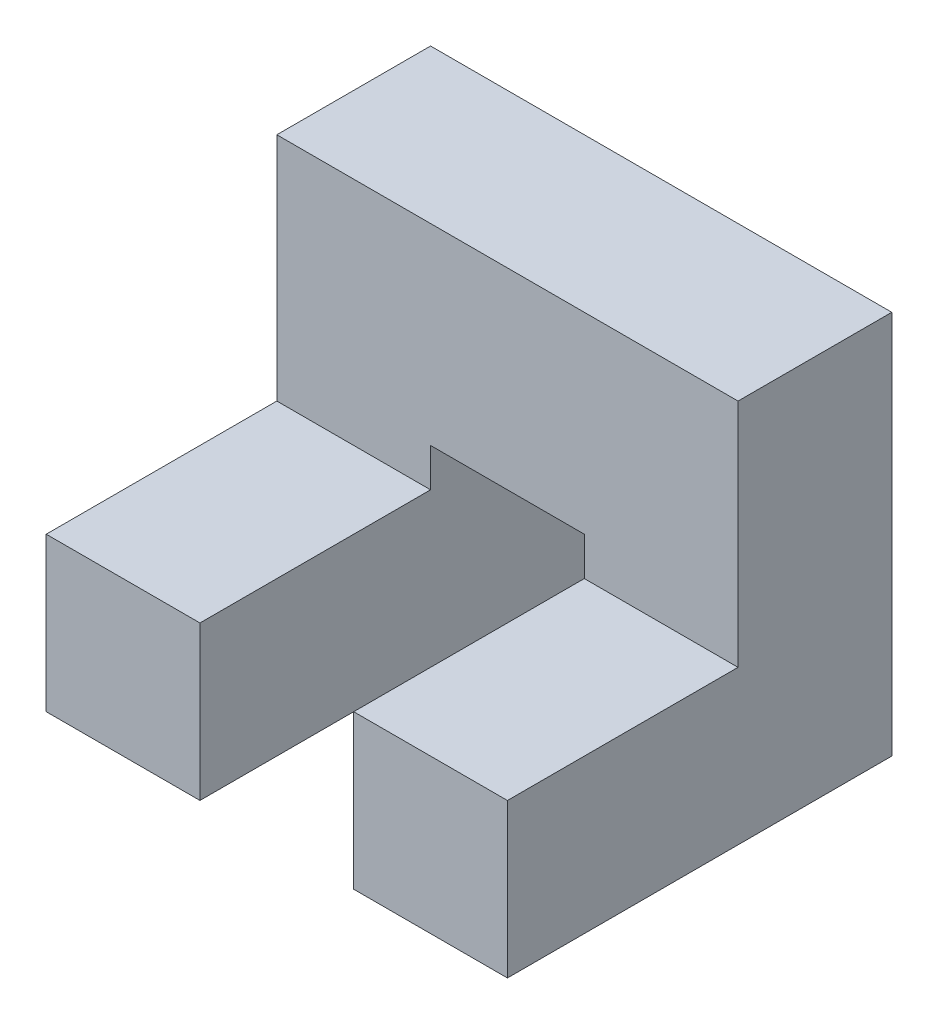
from build123d import *

# Parameters (mm, degrees)
CROQUIS2_W              = 60
CROQUIS2_H              = 50
SALIENTE_EXTRUIR1_DEPTH = 50
CROQUIS3_W              = 60
CROQUIS3_H              = 30
CORTAR_EXTRUIR1_DEPTH   = 35
CROQUIS4_W              = 20
CROQUIS4_H              = 25
CORTAR_EXTRUIR2_DEPTH   = 50
CROQUIS5_W              = 20
CROQUIS5_H              = 30
SALIENTE_EXTRUIR2_DEPTH = 5


with BuildPart() as part:
    # Croquis2 → Saliente-Extruir1 (new body)
    with BuildSketch(Plane.XY):
        Rectangle(CROQUIS2_W, CROQUIS2_H)
    extrude(amount=SALIENTE_EXTRUIR1_DEPTH)

    # Croquis3 → Cortar-Extruir1 (cut)
    with BuildSketch(Plane(origin=(0, 25, 0), x_dir=(1, 0, 0), z_dir=(0, 1, 0))):
        with Locations((0, -35)):
            Rectangle(CROQUIS3_W, CROQUIS3_H)
    extrude(amount=-CORTAR_EXTRUIR1_DEPTH, mode=Mode.SUBTRACT)

    # Croquis4 → Cortar-Extruir2 (cut)
    with BuildSketch(Plane(origin=(0, 0, 0), x_dir=(-1, 0, 0), z_dir=(0, 0, -1))):
        with Locations((0, -12.5)):
            Rectangle(CROQUIS4_W, CROQUIS4_H)
    extrude(amount=-CORTAR_EXTRUIR2_DEPTH, mode=Mode.SUBTRACT)

    # Croquis5 → Saliente-Extruir2 (add)
    with BuildSketch(Plane(origin=(0, -10, 0), x_dir=(1, 0, 0), z_dir=(0, 1, 0))):
        with Locations((20, -35)):
            Rectangle(CROQUIS5_W, CROQUIS5_H)
        with Locations((-20, -35)):
            Rectangle(CROQUIS5_W, CROQUIS5_H)
    extrude(amount=SALIENTE_EXTRUIR2_DEPTH)


solid = part.part
